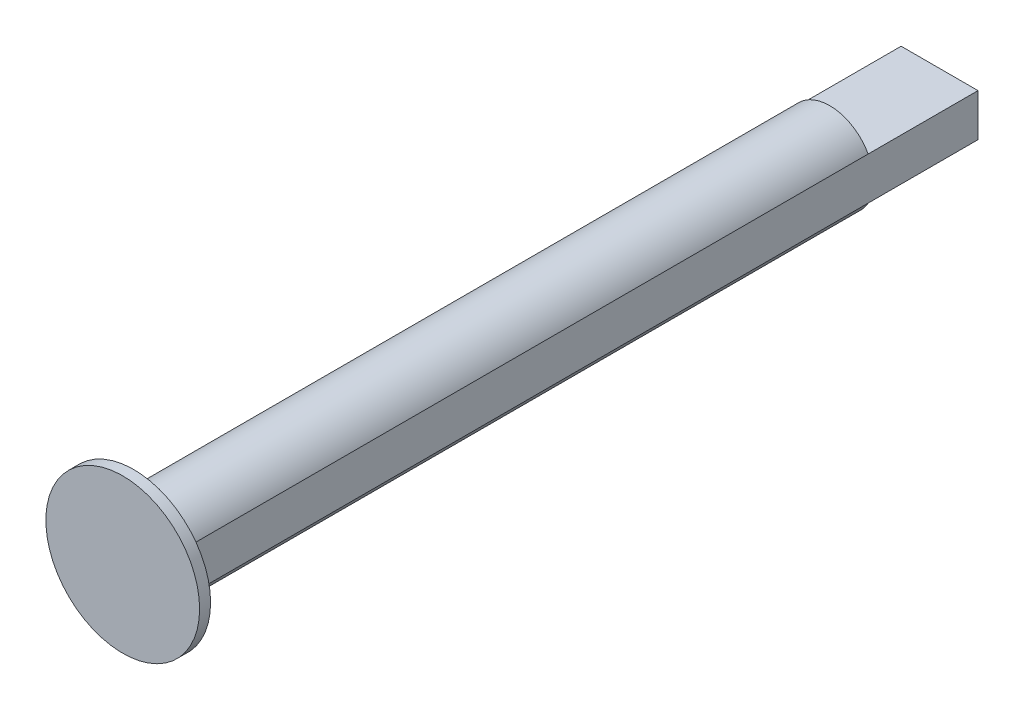
from build123d import *

# Parameters (mm, degrees)
BOSS_EXTRUDE1_DEPTH = 73.3796339
SKETCH2_R           = 7
BOSS_EXTRUDE2_DEPTH = 1
CUT_EXTRUDE1_START  = -10
CUT_EXTRUDE1_DEPTH  = 10


with BuildPart() as part:
    # Sketch1 → Boss-Extrude1 (new body)
    with BuildSketch(Plane.XY):
        with BuildLine():
            Line((3.5, -1.936491673), (3.5, 1.936491673))
            ThreePointArc((3.5, 1.936491673), (-4, 0), (3.5, -1.936491673))
        make_face()
    extrude(amount=-BOSS_EXTRUDE1_DEPTH)

    # Sketch2 → Boss-Extrude2 (add)
    with BuildSketch(Plane.XY):
        Circle(SKETCH2_R)
    extrude(amount=BOSS_EXTRUDE2_DEPTH)

    # Sketch3 → Cut-Extrude1 (cut)
    with BuildSketch(Plane(origin=(0, 0, -73.3796339), x_dir=(-1, 0, 0), z_dir=(0, 0, -1)).offset(CUT_EXTRUDE1_START)):
        with BuildLine():
            Line((-3.5, 1.936491673), (3.5, 1.936491673))
            ThreePointArc((3.5, 1.936491673), (0, 4), (-3.5, 1.936491673))
        make_face()
        with BuildLine():
            Line((-3.5, -1.936491673), (3.5, -1.936491673))
            ThreePointArc((3.5, -1.936491673), (0, -4), (-3.5, -1.936491673))
        make_face()
    extrude(amount=CUT_EXTRUDE1_DEPTH, mode=Mode.SUBTRACT)


solid = part.part
